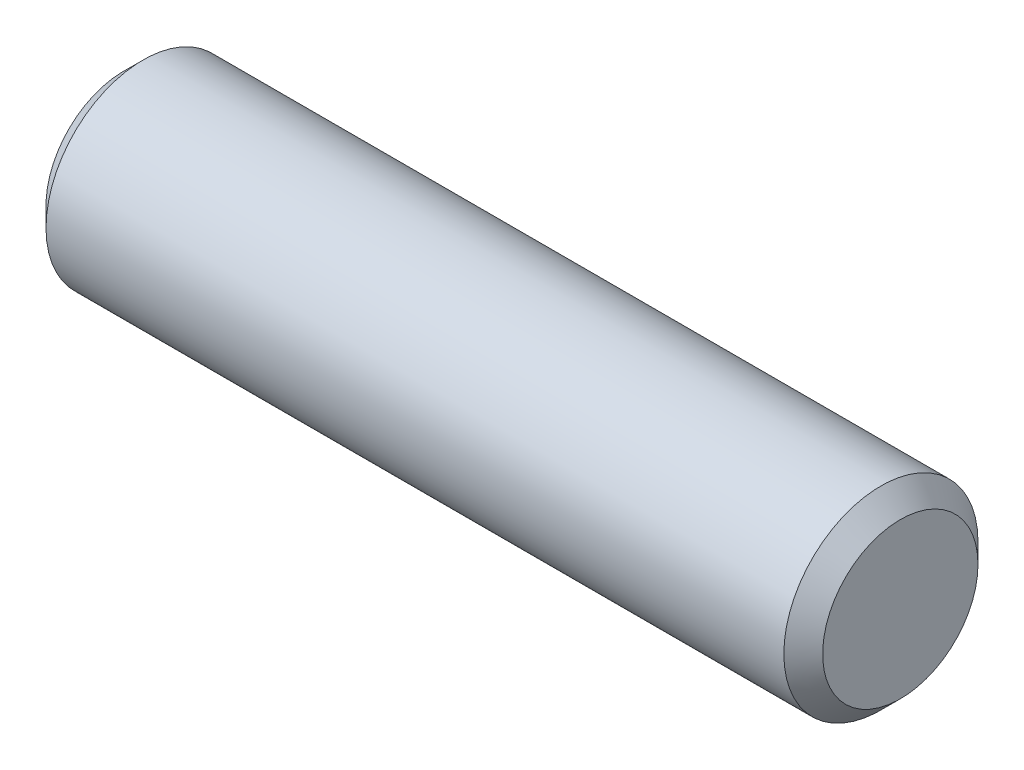
from build123d import *

# Parameters (mm, degrees)
EXTRUDE1_DEPTH      = 50.8
EXTRUDE1_DEPTH_BACK = 50.8
SKETCH2_R           = 12.7
CHAMFER1_SIZE       = 2.54


with BuildPart() as part:
    # Sketch2 → Extrude1 (new, two sides: drawn at the far end of the back side and taken through both)
    with BuildSketch(Plane(origin=(0, 0, 0), x_dir=(0, 0, -1), z_dir=(1, 0, 0)).offset(-EXTRUDE1_DEPTH_BACK)):
        Circle(SKETCH2_R)
    extrude(amount=EXTRUDE1_DEPTH + EXTRUDE1_DEPTH_BACK)

    # Chamfer1
    chamfer1_edges = [part.edges().sort_by_distance(p)[0] for p in [
        (-50.8, 0, 12.7),
        (50.8, 0, 12.7),
    ]]
    chamfer(chamfer1_edges, length=CHAMFER1_SIZE)


solid = part.part
